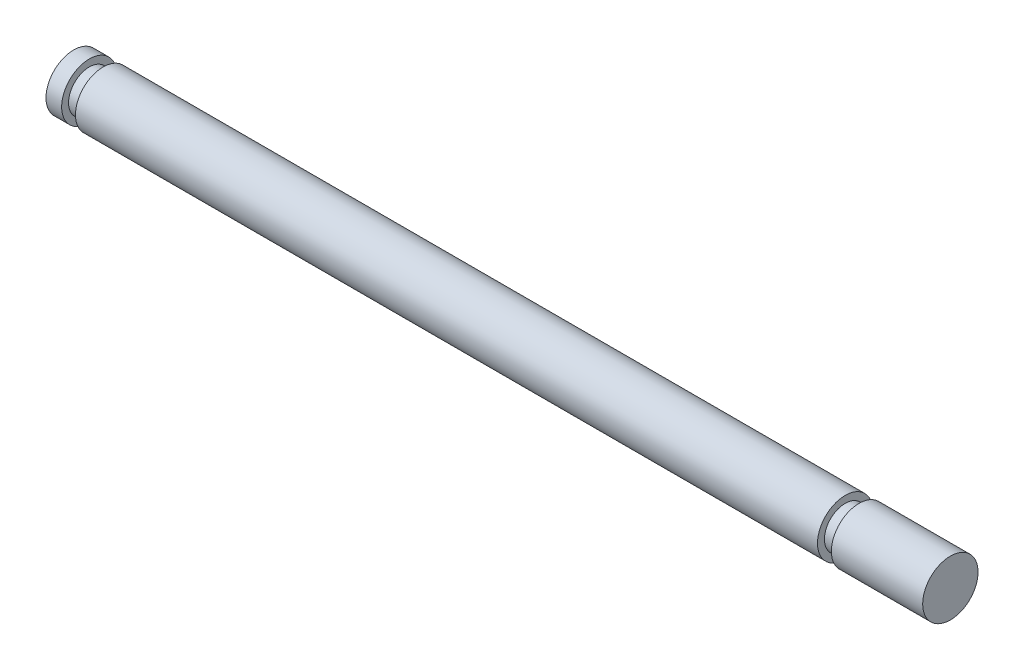
from build123d import *


with BuildPart() as part:
    # Sketch1 → Revolve1 (revolve)
    with BuildSketch(Plane.XY, mode=Mode.PRIVATE) as revolve1_sk:
        Polygon((0, 0), (0, 50), (28.2, 50), (28.2, 37.5), (53.2, 37.5), (53.2, 50), (1393.1, 50), (1393.1, 37.5), (1418.1, 37.5), (1418.1, 50), (1583, 50), (1583, 0), align=None)
    revolve(revolve1_sk.sketch.rotate(Axis((0, 0, 0), (1, 0, 0)), 90), axis=Axis((0, 0, 0), (1, 0, 0)))


solid = part.part
